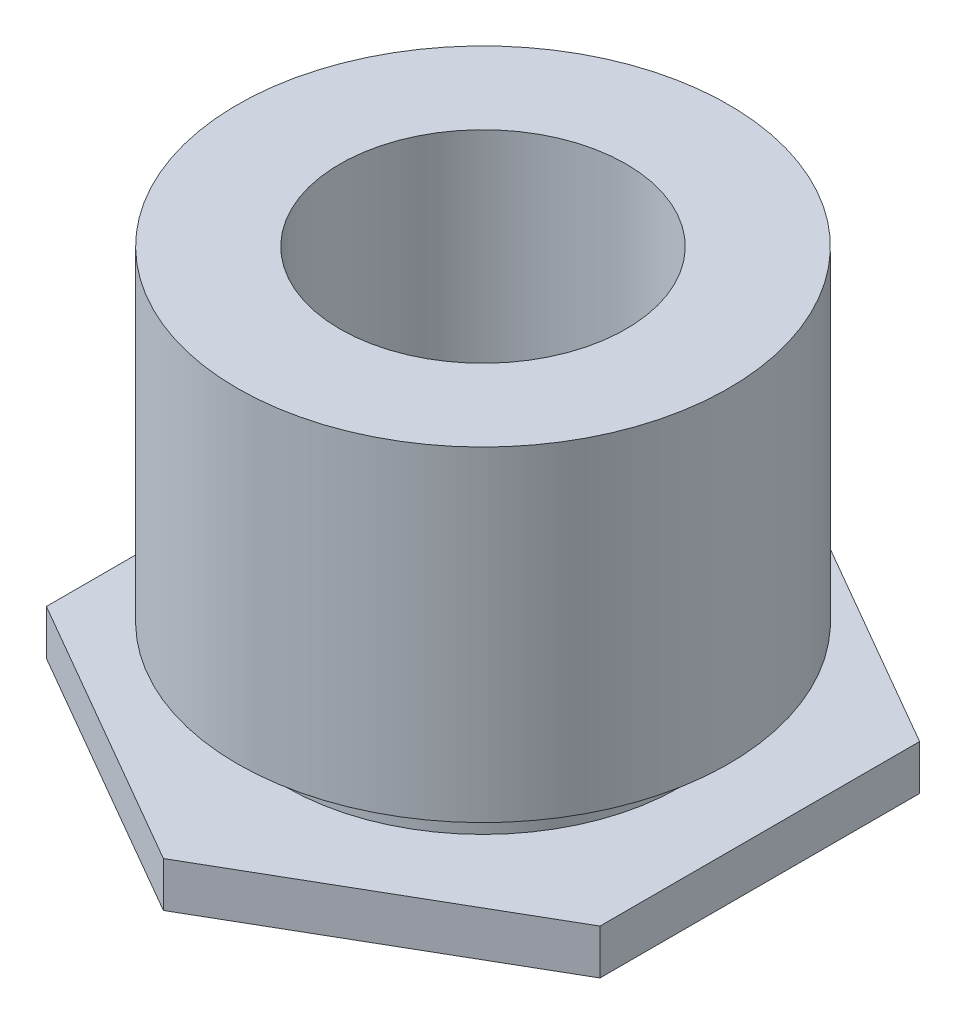
from build123d import *

# Parameters (mm, degrees)
EXTRUDE_1_DEPTH = 0.65


with BuildPart() as part:
    # Эскиз1 → Бобышка-Вытянуть1 (new body)
    with BuildSketch(Plane(origin=(0, 0, 0), x_dir=(1, 0, 0), z_dir=(0, 1, 0))):
        Polygon((0, -4.618802154), (4, -2.309401077), (4, 2.309401077), (0, 4.618802154), (-4, 2.309401077), (-4, -2.309401077), align=None)
    extrude(amount=EXTRUDE_1_DEPTH)

    # Эскиз6 → Повернуть1 (revolve)
    with BuildSketch(Plane.XY, mode=Mode.PRIVATE) as revolve_1_sk:
        Polygon((3.55, 6), (3.55, 1.3), (2.84, 1.3), (2.84, 0.65), (0, 0.65), (0, 2.8), (2.067, 2.8), (2.067, 6), align=None)
    revolve(revolve_1_sk.sketch.rotate(Axis((0, 2.8, 0), (0, -1, 0)), 90), axis=Axis((0, 2.8, 0), (0, -1, 0)))


solid = part.part
